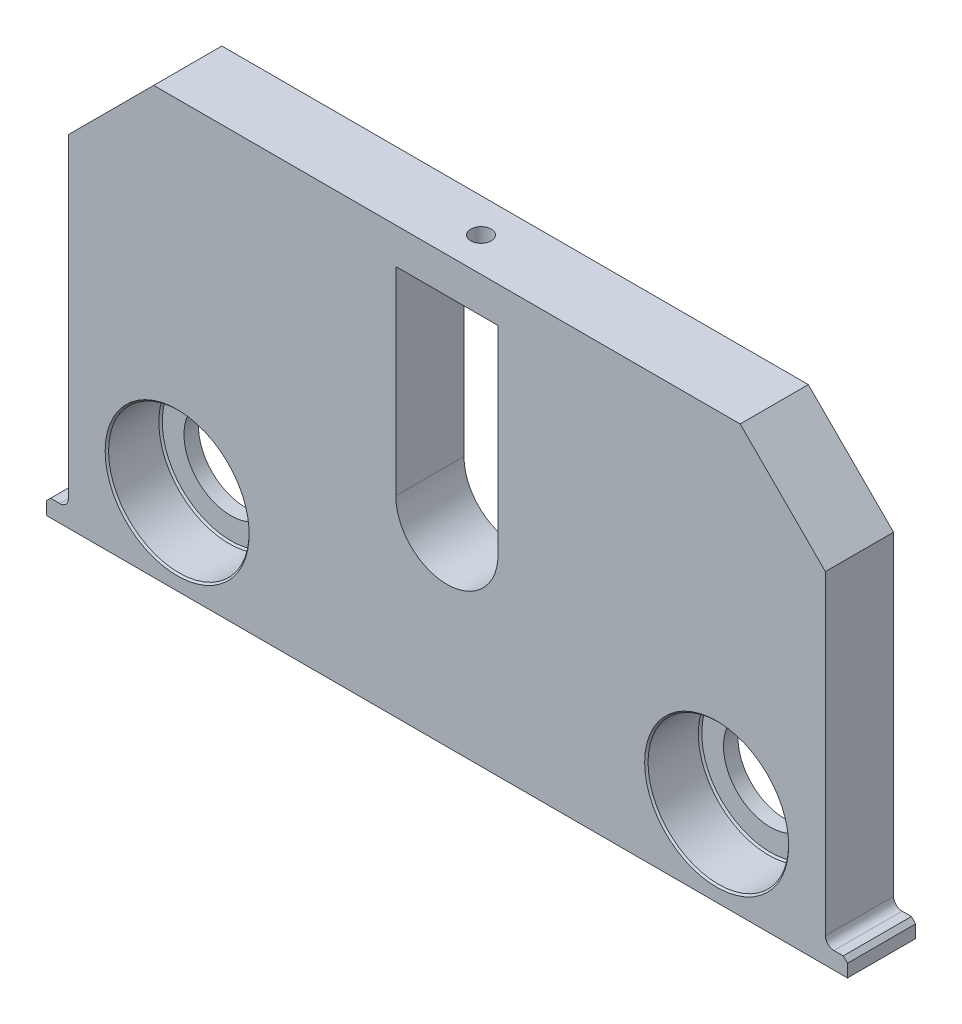
from build123d import *

# Parameters (mm, degrees)
SKETCH1_R           = 55
BOSS_EXTRUDE1_DEPTH = 40
FILLET1_R           = 10
SKETCH2_R           = 12
CUT_EXTRUDE1_DEPTH  = 658.467258663
SKETCH3_R           = 82.5
SKETCH3_R_2         = 55
CUT_EXTRUDE2_DEPTH  = 63
CHAMFER1_SIZE       = 2


with BuildPart() as part:
    # Sketch1 → Boss-Extrude1 (new, symmetric)
    with BuildSketch(Plane.XY):
        Polygon((-445, 0), (445, 0), (470, 0), (470, 15), (465, 20), (444.063252294, 20), (444.063252294, 399.999122503), (344.063252294, 499.999122503), (-344.063252294, 499.999122503), (-444.063252294, 399.999122503), (-444.063252294, 20), (-465, 20), (-470, 15), (-470, 0), align=None)
        with Locations((-316.5, 100)):
            Circle(SKETCH1_R, mode=Mode.SUBTRACT)
        with Locations(Location((316.5, 100, 0), (0, 0, 180))):
            Circle(SKETCH1_R, mode=Mode.SUBTRACT)
        with BuildLine():
            Line((-60, 457.999122503), (60, 457.999122503))
            Line((60, 457.999122503), (60, 225))
            ThreePointArc((60, 225), (0, 165), (-60, 225))
            Line((-60, 225), (-60, 457.999122503))
        make_face(mode=Mode.SUBTRACT)
    extrude(amount=BOSS_EXTRUDE1_DEPTH, both=True)

    # Fillet1
    fillet1_edges = [part.edges().sort_by_distance(p)[0] for p in [
        (444.063252294, 20, 0),
        (-444.063252294, 20, 0),
    ]]
    fillet(fillet1_edges, radius=FILLET1_R)

    # Sketch2 → Cut-Extrude1 (cut, through all)
    with BuildSketch(Plane.XZ.offset(-457.999122503)):
        with Locations(Location((0, 0, 0), (0, 0, 270))):
            Circle(SKETCH2_R)
    extrude(amount=-CUT_EXTRUDE1_DEPTH, mode=Mode.SUBTRACT)

    # Sketch3 → Cut-Extrude2 (cut)
    # profile 1 of 2: a face of its own
    with BuildSketch(Plane.XY.offset(40)):
        with Locations((-316.5, 100)):
            Circle(SKETCH3_R)
        with Locations((-316.5, 100)):
            Circle(SKETCH3_R_2, mode=Mode.SUBTRACT)
    # profile 2 of 2: a face of its own
    with BuildSketch(Plane.XY.offset(40)):
        with Locations((316.5, 100)):
            Circle(SKETCH3_R)
        with Locations(Location((316.5, 100, 0), (0, 0, 180))):
            Circle(SKETCH3_R_2, mode=Mode.SUBTRACT)
    extrude(amount=-CUT_EXTRUDE2_DEPTH, mode=Mode.SUBTRACT)

    # Chamfer1
    chamfer1_edges = [part.edges().sort_by_distance(p)[0] for p in [
        (-399, 100, -23),
        (-399, 100, 40),
        (234, 100, -23),
        (234, 100, 40),
    ]]
    chamfer(chamfer1_edges, length=CHAMFER1_SIZE)


solid = part.part
